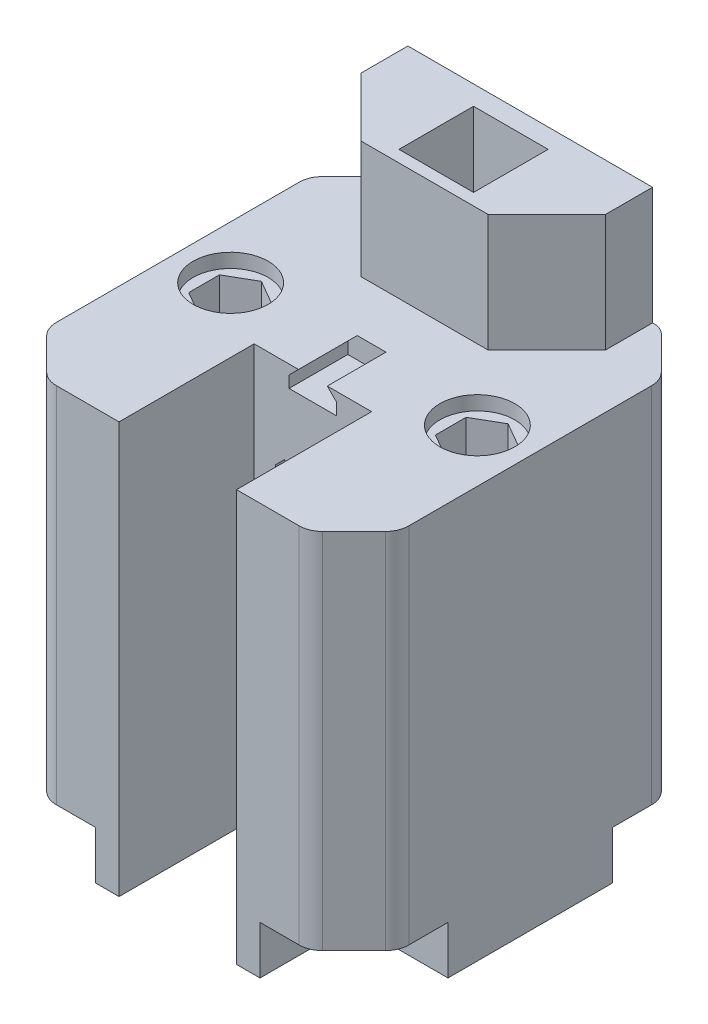
from build123d import *

# Parameters (mm, degrees)
EXTRUDE_1_DEPTH     = 35
SKETCH_4_R          = 1.375
CUT_EXTRUDE_1_DEPTH = 41.926763859
SKETCH_5_W          = 10
SKETCH_5_H          = 11.5
CUT_EXTRUDE_2_DEPTH = 41.926763859
SKETCH_6_W          = 20.825901808
SKETCH_6_H          = 9
EXTRUDE_2_DEPTH     = 10
SKETCH_7_W          = 6.35
SKETCH_7_H          = 6.35
CUT_EXTRUDE_3_DEPTH = 6.5
CUT_EXTRUDE_4_DEPTH = 5
SKETCH_12_R         = 3.19
CUT_EXTRUDE_5_DEPTH = 1.2
SKETCH_13_W         = 4.05
SKETCH_13_H         = 1.8
CUT_EXTRUDE_6_DEPTH = 5
EXTRUDE_3_DEPTH     = 5
CHAMFER_1_SIZE      = 5
SKETCH_18_W         = 8
SKETCH_18_H         = 8
CUT_EXTRUDE_7_DEPTH = 4.1
CHAMFER_2_SIZE      = 2.5
SKETCH_19_R         = 1.625
CUT_EXTRUDE_8_DEPTH = 6
FILLET_1_R          = 2
FILLET_2_R          = 1.5


with BuildPart() as part:
    # 草图3 → 凸台-拉伸1 (new body)
    with BuildSketch(Plane(origin=(0, 0, 0), x_dir=(1, 0, 0), z_dir=(0, 1, 0))):
        Polygon((11.162950904, -15), (15, -11.162950904), (15, 11.162950904), (11.162950904, 15), (-11.162950904, 15), (-15, 11.162950904), (-15, -11.162950904), (-11.162950904, -15), align=None)
    extrude(amount=EXTRUDE_1_DEPTH)

    # 草图4 → 切除-拉伸1 (cut, through all)
    with BuildSketch(Plane(origin=(0, 35, 0), x_dir=(1, 0, 0), z_dir=(0, 1, 0))):
        with Locations(Location((10.5, 0, 0), (0, 0, 270))):
            Circle(SKETCH_4_R)
        with Locations(Location((-10.5, 0, 0), (0, 0, 90))):
            Circle(SKETCH_4_R)
    extrude(amount=-CUT_EXTRUDE_1_DEPTH, mode=Mode.SUBTRACT)

    # 草图5 → 切除-拉伸2 (cut, through all)
    with BuildSketch(Plane(origin=(0, 35, 0), x_dir=(1, 0, 0), z_dir=(0, 1, 0))):
        with Locations((0, -9.25)):
            Rectangle(SKETCH_5_W, SKETCH_5_H)
    extrude(amount=-CUT_EXTRUDE_2_DEPTH, mode=Mode.SUBTRACT)

    # 草图6 → 凸台-拉伸2 (add)
    with BuildSketch(Plane(origin=(0, 35, 0), x_dir=(1, 0, 0), z_dir=(0, 1, 0))):
        with Locations((0, 10.5)):
            Rectangle(SKETCH_6_W, SKETCH_6_H)
    extrude(amount=EXTRUDE_2_DEPTH)

    # 草图7 → 切除-拉伸3 (cut)
    with BuildSketch(Plane(origin=(0, 45, 0), x_dir=(1, 0, 0), z_dir=(0, 1, 0))):
        with Locations((0, 10.175)):
            Rectangle(SKETCH_7_W, SKETCH_7_H)
    cut_extrude_3 = extrude(amount=-CUT_EXTRUDE_3_DEPTH, mode=Mode.SUBTRACT)

    # 切除-扫描1: sweep along a path in 草图9
    with BuildLine(Plane(origin=(0, 0, 0), x_dir=(0, 0, -1), z_dir=(1, 0, 0))) as sweep_1_path:
        Line((10.175, 38.5), (10.175, 33.5))
        ThreePointArc((10.175, 33.5), (7.831854249, 27.843145751), (2.175, 25.5))
        Line((2.175, 25.5), (-3.5, 25.5))
    # 草图8 → 切除-扫描1 (sweep, cut)
    with BuildSketch(Plane(origin=(0, 38.5, 0), x_dir=(1, 0, 0), z_dir=(0, 1, 0))):
        Polygon((1.675, 8.675), (1.675, 11.675), (2.425, 12.425), (3.175, 11.675), (3.175, 8.675), (2.425, 7.925), align=None)
        Polygon((-1.675, 8.675), (-2.425, 7.925), (-3.175, 8.675), (-3.175, 11.675), (-2.425, 12.425), (-1.675, 11.675), align=None)
    sweep_1 = sweep(path=sweep_1_path.line, mode=Mode.SUBTRACT)

    # 镜向1: 切除-拉伸3, 切除-扫描1 across plane
    add(cut_extrude_3.mirror(Plane.ZX.offset(22.5)), mode=Mode.SUBTRACT)
    add(sweep_1.mirror(Plane.ZX.offset(22.5)), mode=Mode.SUBTRACT)

    # 草图11 → 切除-拉伸4 (cut)
    with BuildSketch(Plane(origin=(0, 35, 0), x_dir=(1, 0, 0), z_dir=(0, 1, 0))):
        Polygon((10.5, 2.615396719), (8.235, 1.30769836), (8.235, -1.30769836), (10.5, -2.615396719), (12.765, -1.30769836), (12.765, 1.30769836), align=None)
        Polygon((-10.5, -2.615396719), (-12.765, -1.30769836), (-12.765, 1.30769836), (-10.5, 2.615396719), (-8.235, 1.30769836), (-8.235, -1.30769836), align=None)
    cut_extrude_4 = extrude(amount=-CUT_EXTRUDE_4_DEPTH, mode=Mode.SUBTRACT)

    # 草图12 → 切除-拉伸5 (cut)
    with BuildSketch(Plane(origin=(0, 35, 0), x_dir=(1, 0, 0), z_dir=(0, 1, 0))):
        with Locations(Location((10.5, 0, 0), (0, 0, 270))):
            Circle(SKETCH_12_R)
        with Locations(Location((-10.5, 0, 0), (0, 0, 90))):
            Circle(SKETCH_12_R)
    cut_extrude_5 = extrude(amount=-CUT_EXTRUDE_5_DEPTH, mode=Mode.SUBTRACT)

    # 草图13 → 切除-拉伸6 (cut)
    with BuildSketch(Plane.XY.offset(3.5)):
        with Locations((0, 34.1)):
            Rectangle(SKETCH_13_W, SKETCH_13_H)
    extrude(amount=-CUT_EXTRUDE_6_DEPTH, mode=Mode.SUBTRACT)

    # 草图14 → 凸台-拉伸3 (add)
    with BuildSketch(Plane.XY.offset(-1.5)):
        Polygon((1.225, 35), (2.025, 35), (2.025, 34.2), align=None)
        Polygon((-2.025, 34.2), (-1.225, 35), (-2.025, 35), align=None)
    extrude(amount=EXTRUDE_3_DEPTH)

    # 倒角1
    chamfer_1_edges = [part.edges().sort_by_distance(p)[0] for p in [
        (10.412950904, 40, -6),
        (-10.412950904, 40, -6),
    ]]
    chamfer(chamfer_1_edges, length=CHAMFER_1_SIZE)

    # 草图18 → 切除-拉伸7 (cut)
    with BuildSketch(Plane.XZ):
        with Locations((11, -11)):
            Rectangle(SKETCH_18_W, SKETCH_18_H)
        with Locations((-11, -11)):
            Rectangle(SKETCH_18_W, SKETCH_18_H)
        with Locations((-11, 11)):
            Rectangle(SKETCH_18_W, SKETCH_18_H)
        with Locations((11, 11)):
            Rectangle(SKETCH_18_W, SKETCH_18_H)
    extrude(amount=-CUT_EXTRUDE_7_DEPTH, mode=Mode.SUBTRACT)

    # 倒角2
    chamfer_2_edges = [part.edges().sort_by_distance(p)[0] for p in [
        (7, 2.05, 7),
        (-7, 2.05, 7),
        (-7, 2.05, -7),
        (7, 2.05, -7),
    ]]
    chamfer(chamfer_2_edges, length=CHAMFER_2_SIZE)

    # 镜向2: 切除-拉伸4, 切除-拉伸5 across plane
    add(cut_extrude_4.mirror(Plane.ZX.offset(17.5)), mode=Mode.SUBTRACT)
    add(cut_extrude_5.mirror(Plane.ZX.offset(17.5)), mode=Mode.SUBTRACT)

    # 草图19 → 切除-拉伸8 (cut)
    with BuildSketch(Plane.XZ.offset(-4.1)):
        with Locations(Location((11, -11, 0), (0, 0, 270))):
            Circle(SKETCH_19_R)
        with Locations(Location((-11, -11, 0), (0, 0, 270))):
            Circle(SKETCH_19_R)
        with Locations(Location((-11, 11, 0), (0, 0, 270))):
            Circle(SKETCH_19_R)
        with Locations(Location((11, 11, 0), (0, 0, 270))):
            Circle(SKETCH_19_R)
    extrude(amount=-CUT_EXTRUDE_8_DEPTH, mode=Mode.SUBTRACT)

    # 圆角1
    fillet_1_edges = [part.edges().sort_by_distance(p)[0] for p in [
        (-11.162950904, 19.55, 15),
        (-15, 19.55, 11.162950904),
        (-15, 19.55, -11.162950904),
        (15, 19.55, -11.162950904),
        (15, 19.55, 11.162950904),
        (11.162950904, 19.55, 15),
    ]]
    fillet(fillet_1_edges, radius=FILLET_1_R)

    # 圆角2
    fillet_2_edges = [part.edges().sort_by_distance(p)[0] for p in [
        (-11.162950904, 19.55, -15),
        (11.162950904, 19.55, -15),
    ]]
    fillet(fillet_2_edges, radius=FILLET_2_R)


solid = part.part
